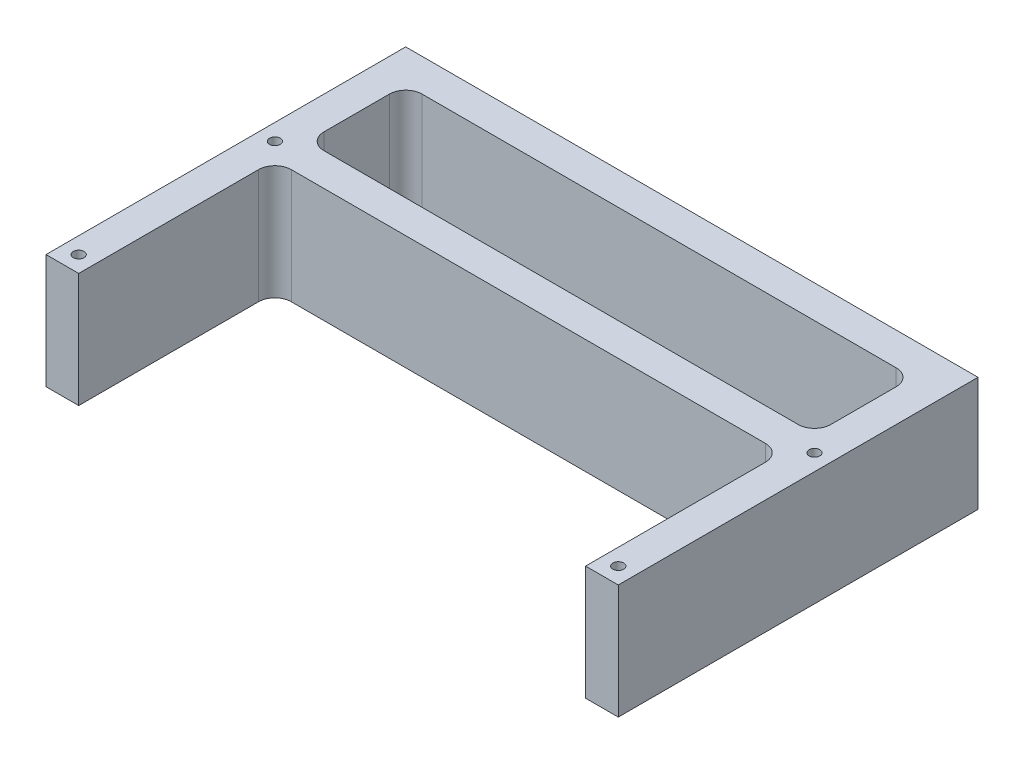
from build123d import *

# Parameters (mm, degrees)
SKETCH1_W                  = 155
SKETCH1_H                  = 30
BOSS_EXTRUDE1_DEPTH        = 17.5
FILLET1_R                  = 5
M4_TAPPED_HOLE2_AT_2_COUNT = 2
M4_TAPPED_HOLE2_AT_2_PITCH = 60
M4_TAPPED_HOLE2_AT_3_COUNT = 2
M4_TAPPED_HOLE2_AT_3_PITCH = 175.570498661
M4_TAPPED_HOLE2_AT_4_COUNT = 2
M4_TAPPED_HOLE2_AT_4_PITCH = 165


with BuildPart() as part:
    # Sketch1 → Boss-Extrude1 (new, symmetric)
    with BuildSketch(Plane(origin=(0, 0, 0), x_dir=(1, 0, 0), z_dir=(0, 1, 0))):
        Polygon((-87.5, 25), (87.5, 25), (87.5, -25), (87.5, -85), (77.5, -85), (77.5, -25), (-77.5, -25), (-77.5, -85), (-87.5, -85), (-87.5, -25), align=None)
        Rectangle(SKETCH1_W, SKETCH1_H, mode=Mode.SUBTRACT)
    extrude(amount=BOSS_EXTRUDE1_DEPTH, both=True)

    # Fillet1
    fillet1_edges = [part.edges().sort_by_distance(p)[0] for p in [
        (77.5, 0, 25),
        (-77.5, 0, 25),
        (-77.5, 0, 15),
        (-77.5, 0, -15),
        (77.5, 0, -15),
        (77.5, 0, 15),
    ]]
    fillet(fillet1_edges, radius=FILLET1_R)

    # Sketch4 → M4 Tapped Hole2 (revolve, cut)
    with BuildSketch(Plane(origin=(-82.5, 17.5, 20), x_dir=(0, 0, 1), z_dir=(1, 0, 0))):
        Polygon((0, 0), (0, 16.991420021), (1.65, 16), (1.65, 0), align=None)
    m4_tapped_hole2 = revolve(axis=Axis((-82.5, 23.85, 20), (0, -1, 0)), mode=Mode.SUBTRACT)

    # M4 Tapped Hole2 at 2: M4 Tapped Hole2 ×2
    with Locations(*[(0, 0, i * M4_TAPPED_HOLE2_AT_2_PITCH) for i in range(1, M4_TAPPED_HOLE2_AT_2_COUNT)]):
        add(m4_tapped_hole2, mode=Mode.SUBTRACT)

    # M4 Tapped Hole2 at 3: M4 Tapped Hole2 ×2
    with Locations(*[Vector(0.9397934234884371, 0, 0.3417430630867045) * (i * M4_TAPPED_HOLE2_AT_3_PITCH) for i in range(1, M4_TAPPED_HOLE2_AT_3_COUNT)]):
        add(m4_tapped_hole2, mode=Mode.SUBTRACT)

    # M4 Tapped Hole2 at 4: M4 Tapped Hole2 ×2
    with Locations(*[(i * M4_TAPPED_HOLE2_AT_4_PITCH, 0, 0) for i in range(1, M4_TAPPED_HOLE2_AT_4_COUNT)]):
        add(m4_tapped_hole2, mode=Mode.SUBTRACT)

    # Mirror1: M4 Tapped Hole2 across plane
    add(m4_tapped_hole2.mirror(Plane.ZX), mode=Mode.SUBTRACT)

    # Mirror1 copy 1 sketch → Mirror1 copy 1 (revolve, cut)
    with BuildSketch(Plane(origin=(-82.5, -17.5, 80), x_dir=(0, 0, 1), z_dir=(1, 0, 0))):
        Polygon((0, 0), (0, -16.991420021), (1.65, -16), (1.65, 0), align=None)
    revolve(axis=Axis((-82.5, -23.85, 80), (0, -1, 0)), mode=Mode.SUBTRACT)

    # Mirror1 copy 2 sketch → Mirror1 copy 2 (revolve, cut)
    with BuildSketch(Plane(origin=(82.5, -17.5, 80), x_dir=(0, 0, 1), z_dir=(1, 0, 0))):
        Polygon((0, 0), (0, -16.991420021), (1.65, -16), (1.65, 0), align=None)
    revolve(axis=Axis((82.5, -23.85, 80), (0, -1, 0)), mode=Mode.SUBTRACT)

    # Mirror1 copy 3 sketch → Mirror1 copy 3 (revolve, cut)
    with BuildSketch(Plane(origin=(82.5, -17.5, 20), x_dir=(0, 0, 1), z_dir=(1, 0, 0))):
        Polygon((0, 0), (0, -16.991420021), (1.65, -16), (1.65, 0), align=None)
    revolve(axis=Axis((82.5, -23.85, 20), (0, -1, 0)), mode=Mode.SUBTRACT)


solid = part.part
